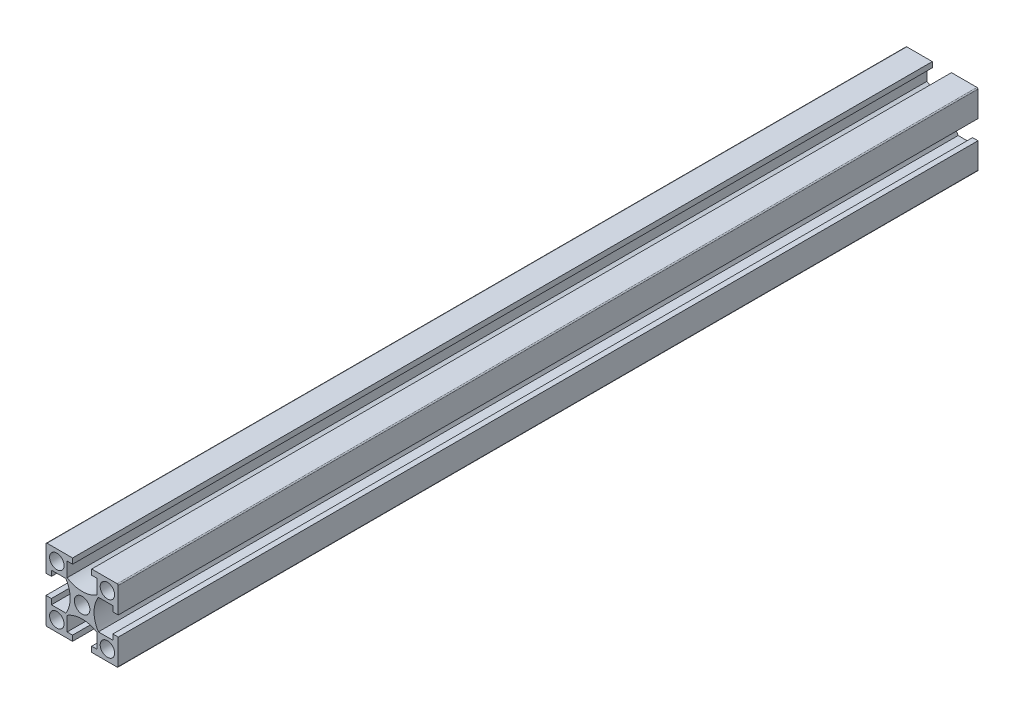
from build123d import *

# Parameters (mm, degrees)
SKETCH_1_W               = 20
SKETCH_1_H               = 20
SKETCH_1_R               = 2
SKETCH_1_R_2             = 2.15
EXTRUDE_1_DEPTH          = 238
CUT_EXTRUDE_1_REACH      = 240.42
PATTERN_CIRCULAR_1_COUNT = 4
FILLET_1_R               = 0.3


with BuildPart() as part:
    # 스케치1 → 보스-돌출1 (new body)
    with BuildSketch(Plane.XY):
        Rectangle(SKETCH_1_W, SKETCH_1_H)
        with Locations((-7, -7)):
            Circle(SKETCH_1_R, mode=Mode.SUBTRACT)
        with Locations((7, -7)):
            Circle(SKETCH_1_R, mode=Mode.SUBTRACT)
        with Locations((-7, 7)):
            Circle(SKETCH_1_R, mode=Mode.SUBTRACT)
        Circle(SKETCH_1_R_2, mode=Mode.SUBTRACT)
        with Locations((7, 7)):
            Circle(SKETCH_1_R, mode=Mode.SUBTRACT)
    extrude(amount=EXTRUDE_1_DEPTH)

    # 스케치1<3> → 컷-돌출1 (cut, up to next)
    with BuildSketch(Plane.XY, mode=Mode.PRIVATE) as cut_extrude_1_sk1:
        with BuildLine():
            Line((-8.5, 2.65), (-10, 2.65))
            Line((-10, 2.65), (-10, -2.65))
            Line((-10, -2.65), (-8.5, -2.65))
            Line((-8.5, -2.65), (-8.5, -4.15))
            Line((-8.5, -4.15), (-4.503166667, -4.15))
            ThreePointArc((-4.503166667, -4.15), (-3.3, 0), (-4.503166667, 4.15))
            Line((-4.503166667, 4.15), (-8.5, 4.15))
            Line((-8.5, 4.15), (-8.5, 2.65))
        make_face()
    cut_extrude_1_tool1 = extrude(cut_extrude_1_sk1.sketch, amount=CUT_EXTRUDE_1_REACH, mode=Mode.PRIVATE) & part.part
    cut_extrude_1 = cut_extrude_1_tool1.solids().sort_by_distance((-6.606913, 0, 0))[0]
    add(cut_extrude_1, mode=Mode.SUBTRACT)

    # 원형 패턴1: 컷-돌출1 ×4 about axis
    pattern_circular_1_axis = Axis((0, 0, 238), (0, 0, -1))
    for i in range(1, PATTERN_CIRCULAR_1_COUNT):
        add(cut_extrude_1.rotate(pattern_circular_1_axis, i * 360 / PATTERN_CIRCULAR_1_COUNT), mode=Mode.SUBTRACT)

    # 필렛1
    fillet_1_edges = [part.edges().sort_by_distance(p)[0] for p in [
        (10, -10, 119),
        (-10, -10, 119),
        (-10, 10, 119),
        (10, 10, 119),
    ]]
    fillet(fillet_1_edges, radius=FILLET_1_R)


solid = part.part
